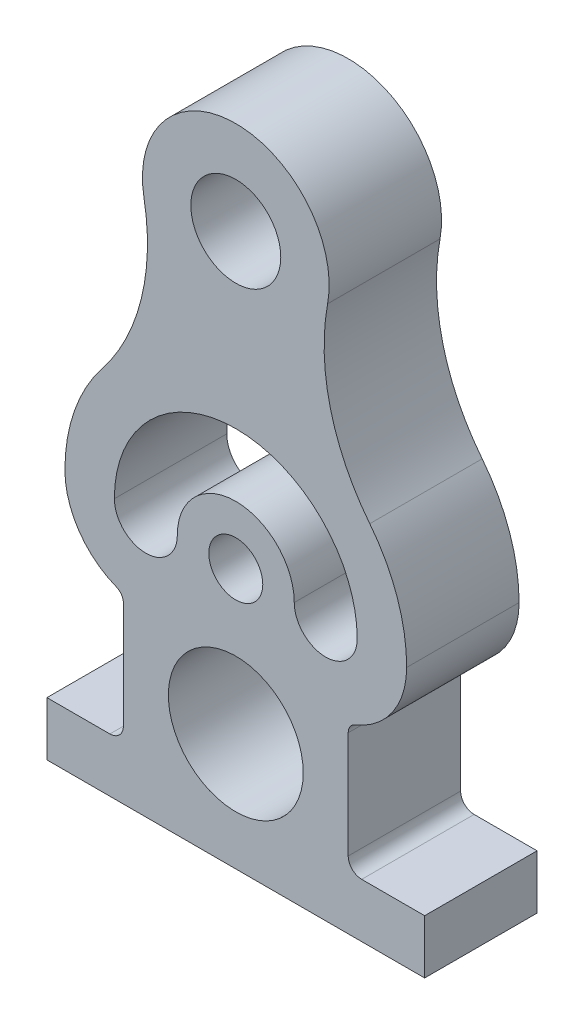
from build123d import *

# Parameters (mm, degrees)
SKETCH1_R           = 30
SKETCH1_R_2         = 12
SKETCH1_R_3         = 20
BOSS_EXTRUDE1_DEPTH = 50
FILLET1_R           = 6
FILLET2_R           = 5


with BuildPart() as part:
    # Sketch1 → Boss-Extrude1 (new body)
    with BuildSketch(Plane.XY):
        with BuildLine():
            Line((0, 0), (168, 0))
            Line((168, 0), (168, 24))
            Line((168, 24), (134, 24))
            Line((134, 24), (134, 81.030415331))
            ThreePointArc((134, 81.030415331), (152.77498914, 93.98034061), (160, 115.613648263))
            ThreePointArc((160, 115.613648263), (155.780100416, 140.585976635), (143.589021465, 162.785128215))
            ThreePointArc((143.589021465, 162.785128215), (126.074856949, 198.422570769), (124.838141772, 238.111911984))
            ThreePointArc((124.838141772, 238.111911984), (84, 287.13508695), (43.161858228, 238.111911984))
            ThreePointArc((43.161858228, 238.111911984), (41.925143051, 198.422570769), (24.410978535, 162.785128215))
            ThreePointArc((24.410978535, 162.785128215), (12.219899584, 140.585976635), (8, 115.613648263))
            ThreePointArc((8, 115.613648263), (15.22501086, 93.98034061), (34, 81.030415331))
            Line((34, 81.030415331), (34, 24))
            Line((34, 24), (0, 24))
            Line((0, 24), (0, 0))
        make_face()
        with Locations((84, 52)):
            Circle(SKETCH1_R, mode=Mode.SUBTRACT)
        with Locations((84, 115.613648263)):
            Circle(SKETCH1_R_2, mode=Mode.SUBTRACT)
        with Locations((84, 245.613648263)):
            Circle(SKETCH1_R_3, mode=Mode.SUBTRACT)
        with BuildLine():
            ThreePointArc((110, 115.613648263), (84, 141.613648263), (58, 115.613648263))
            ThreePointArc((58, 115.613648263), (44, 101.613648263), (30, 115.613648263))
            ThreePointArc((30, 115.613648263), (84, 169.613648263), (138, 115.613648263))
            ThreePointArc((138, 115.613648263), (124, 101.613648263), (110, 115.613648263))
        make_face(mode=Mode.SUBTRACT)
    extrude(amount=BOSS_EXTRUDE1_DEPTH)

    # Fillet1
    fillet1_edges = [part.edges().sort_by_distance(p)[0] for p in [
        (34, 24, 25),
        (134, 24, 25),
    ]]
    fillet(fillet1_edges, radius=FILLET1_R)

    # Fillet2
    fillet2_edges = [part.edges().sort_by_distance(p)[0] for p in [
        (34, 81.030415331, 25),
        (134, 81.030415331, 25),
    ]]
    fillet(fillet2_edges, radius=FILLET2_R)


solid = part.part
